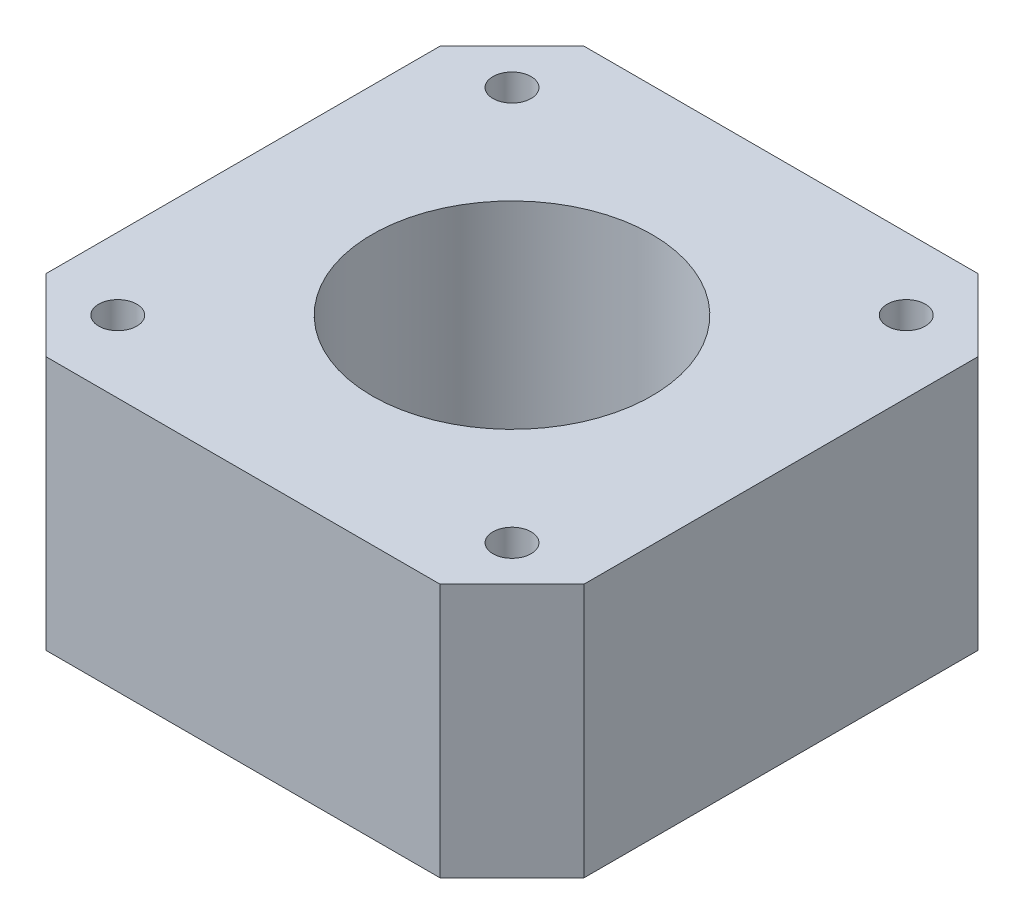
from build123d import *

# Parameters (mm, degrees)
SKETCH1_R           = 1.5
SKETCH1_R_2         = 11
BOSS_EXTRUDE1_DEPTH = 20
SKETCH1_3_R         = 1.5
BOSS_EXTRUDE2_DEPTH = 17.5


with BuildPart() as part:
    # Sketch1 → Boss-Extrude1 (new body)
    with BuildSketch(Plane(origin=(0, 0, 0), x_dir=(1, 0, 0), z_dir=(0, 1, 0))):
        Polygon((-15.493145751, 21.15), (-21.15, 15.493145751), (-21.15, -15.493145751), (-15.493145751, -21.15), (15.493145751, -21.15), (21.15, -15.493145751), (21.15, 15.493145751), (15.493145751, 21.15), (12, 21.15), (-12, 21.15), align=None)
        with Locations(Location((-15.5, -15.5, 0), (0, 0, 270))):
            Circle(SKETCH1_R, mode=Mode.SUBTRACT)
        with Locations(Location((15.5, -15.5, 0), (0, 0, 270))):
            Circle(SKETCH1_R, mode=Mode.SUBTRACT)
        with Locations(Location((0, 0, 0), (0, 0, 270))):
            Circle(SKETCH1_R_2, mode=Mode.SUBTRACT)
        with Locations(Location((-15.5, 15.5, 0), (0, 0, 270))):
            Circle(SKETCH1_R, mode=Mode.SUBTRACT)
        with Locations(Location((15.5, 15.5, 0), (0, 0, 270))):
            Circle(SKETCH1_R, mode=Mode.SUBTRACT)
    extrude(amount=BOSS_EXTRUDE1_DEPTH)

    # Sketch1<3> → Boss-Extrude2 (add)
    with BuildSketch(Plane(origin=(0, 0, 0), x_dir=(1, 0, 0), z_dir=(0, 1, 0))):
        with Locations(Location((15.5, -15.5, 0), (0, 0, 270))):
            Circle(SKETCH1_3_R)
        with Locations(Location((-15.5, -15.5, 0), (0, 0, 270))):
            Circle(SKETCH1_3_R)
        with Locations(Location((15.5, 15.5, 0), (0, 0, 270))):
            Circle(SKETCH1_3_R)
        with Locations(Location((-15.5, 15.5, 0), (0, 0, 270))):
            Circle(SKETCH1_3_R)
    extrude(amount=BOSS_EXTRUDE2_DEPTH)


solid = part.part
